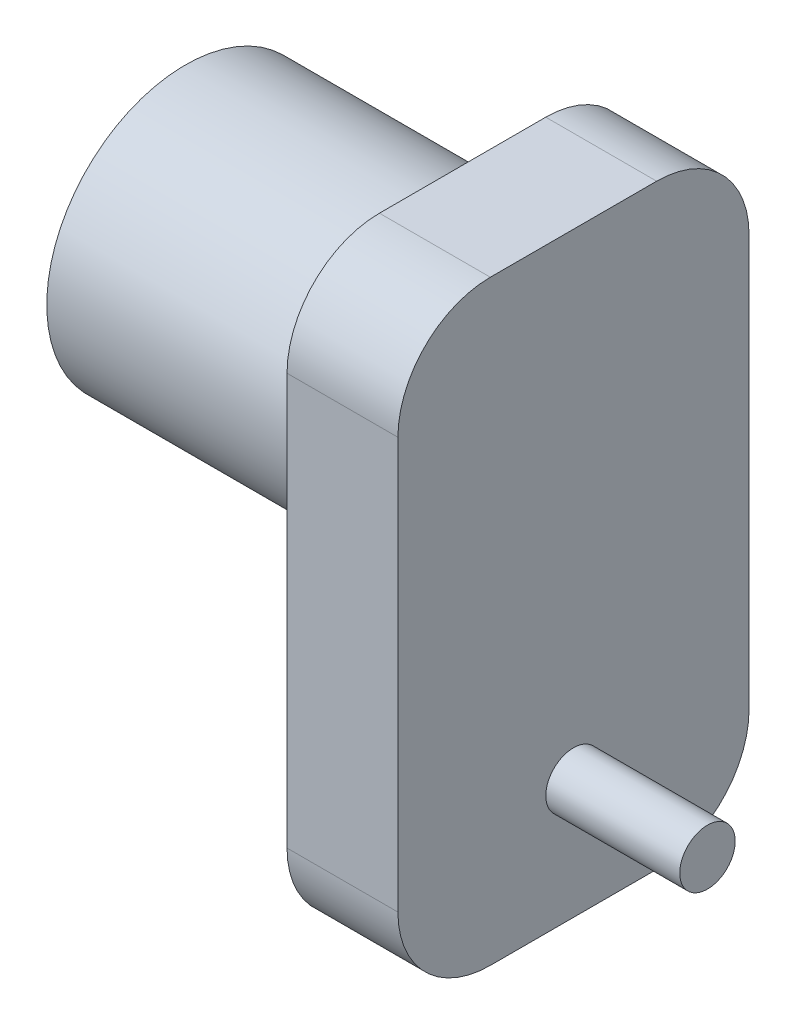
from build123d import *

# Parameters (mm, degrees)
SKETCH_1_R      = 15
EXTRUDE_1_DEPTH = 30
EXTRUDE_2_DEPTH = 12
SKETCH_9_R      = 3
EXTRUDE_3_DEPTH = 14.5


with BuildPart() as part:
    # 草图1 → 凸台-拉伸1 (new body)
    with BuildSketch(Plane(origin=(0, 0, 0), x_dir=(0, 0, -1), z_dir=(1, 0, 0))):
        Circle(SKETCH_1_R)
    extrude(amount=-EXTRUDE_1_DEPTH)

    # 草图8 → 凸台-拉伸2 (add)
    with BuildSketch(Plane(origin=(0, 0, 0), x_dir=(0, 0, -1), z_dir=(1, 0, 0))):
        with BuildLine():
            Line((19, 10.6), (19, -33.9))
            ThreePointArc((19, -33.9), (16.071067812, -40.971067812), (9, -43.9))
            Line((9, -43.9), (-9, -43.9))
            ThreePointArc((-9, -43.9), (-16.071067812, -40.971067812), (-19, -33.9))
            Line((-19, -33.9), (-19, 10.6))
            ThreePointArc((-19, 10.6), (-16.071067812, 17.671067812), (-9, 20.6))
            Line((-9, 20.6), (9, 20.6))
            ThreePointArc((9, 20.6), (16.071067812, 17.671067812), (19, 10.6))
        make_face()
    extrude(amount=EXTRUDE_2_DEPTH)

    # 草图9 → 凸台-拉伸3 (add)
    with BuildSketch(Plane(origin=(12, 0, 0), x_dir=(0, 0, -1), z_dir=(1, 0, 0))):
        with Locations(Location((0, -31, 0), (0, 0, 180))):
            Circle(SKETCH_9_R)
    extrude(amount=EXTRUDE_3_DEPTH)


solid = part.part
